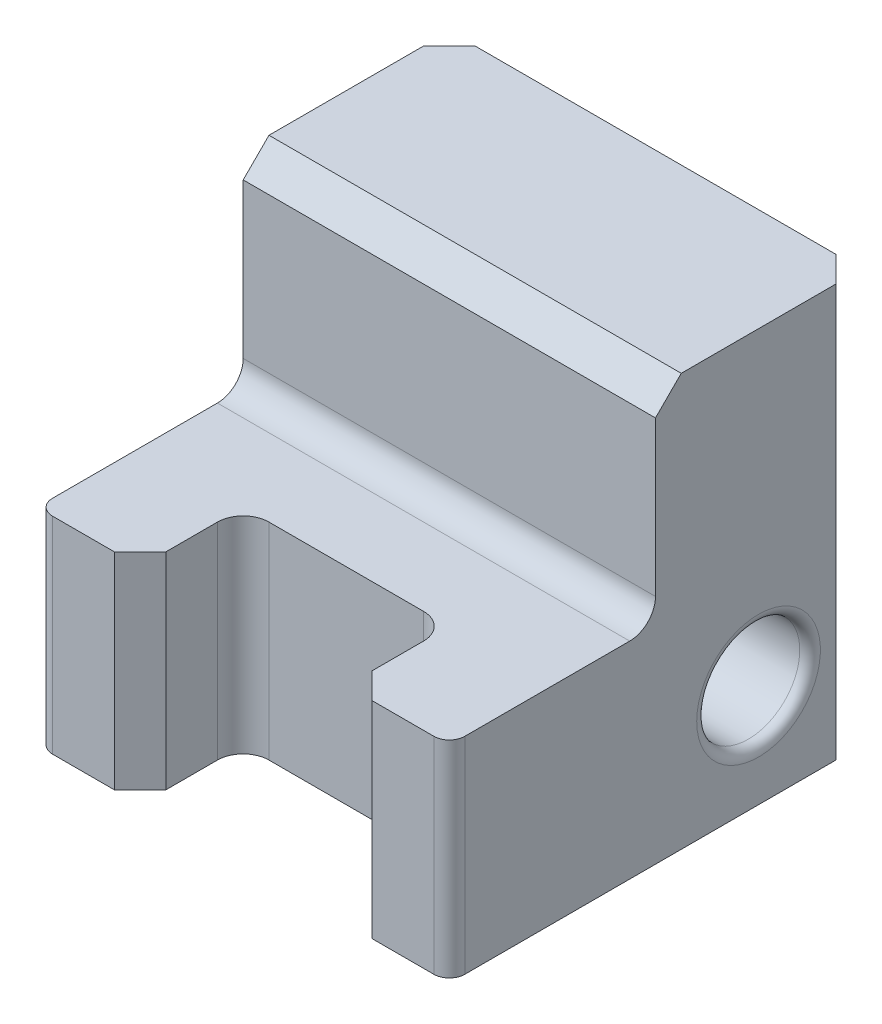
from build123d import *

# Parameters (mm, degrees)
SKETCH4_R           = 10
BOSS_EXTRUDE1_DEPTH = 80
SKETCH5_W           = 40
SKETCH5_H           = 20
CUT_EXTRUDE1_DEPTH  = 139.564064606
FILLET1_R           = 3
CHAMFER1_SIZE       = 5
FILLET2_R           = 5
FILLET4_R           = 5
CHAMFER3_SIZE       = 5
FILLET5_R           = 2
FILLET6_R           = 2
CHAMFER4_SIZE       = 5
CHAMFER5_SIZE       = 5


with BuildPart() as part:
    # Sketch4 → Boss-Extrude1 (new body)
    with BuildSketch(Plane(origin=(0, 0, 0), x_dir=(0, 0, -1), z_dir=(1, 0, 0))):
        Polygon((0, 0), (-80, 0), (-80, 40), (-40, 40), (-40, 80), (0, 80), align=None)
        with Locations((-20, 20)):
            Circle(SKETCH4_R, mode=Mode.SUBTRACT)
    extrude(amount=BOSS_EXTRUDE1_DEPTH)

    # Sketch5 → Cut-Extrude1 (cut, through all)
    with BuildSketch(Plane.XZ):
        with Locations((40, 70)):
            Rectangle(SKETCH5_W, SKETCH5_H)
    extrude(amount=-CUT_EXTRUDE1_DEPTH, mode=Mode.SUBTRACT)

    # Fillet1
    fillet1_edges = [part.edges().sort_by_distance(p)[0] for p in [
        (80, 20, 80),
        (0, 20, 80),
    ]]
    fillet(fillet1_edges, radius=FILLET1_R)

    # Chamfer1
    chamfer1_edges = [part.edges().sort_by_distance(p)[0] for p in [
        (60, 20, 80),
        (20, 20, 80),
    ]]
    chamfer(chamfer1_edges, length=CHAMFER1_SIZE)

    # Fillet2
    fillet2_edges = [part.edges().sort_by_distance(p)[0] for p in [
        (20, 20, 60),
        (60, 20, 60),
    ]]
    fillet(fillet2_edges, radius=FILLET2_R)

    # Fillet4
    fillet4_edges = [part.edges().sort_by_distance(p)[0] for p in [
        (40, 40, 40),
    ]]
    fillet(fillet4_edges, radius=FILLET4_R)

    # Chamfer3
    chamfer3_edges = [part.edges().sort_by_distance(p)[0] for p in [
        (40, 80, 40),
    ]]
    chamfer(chamfer3_edges, length=CHAMFER3_SIZE)

    # Fillet5
    fillet5_edges = [part.edges().sort_by_distance(p)[0] for p in [
        (0, 20, 30),
    ]]
    fillet(fillet5_edges, radius=FILLET5_R)

    # Fillet6
    fillet6_edges = [part.edges().sort_by_distance(p)[0] for p in [
        (80, 20, 30),
    ]]
    fillet(fillet6_edges, radius=FILLET6_R)

    # Chamfer4
    chamfer4_edges = [part.edges().sort_by_distance(p)[0] for p in [
        (80, 40, 0),
    ]]
    chamfer(chamfer4_edges, length=CHAMFER4_SIZE)

    # Chamfer5
    chamfer5_edges = [part.edges().sort_by_distance(p)[0] for p in [
        (0, 40, 0),
    ]]
    chamfer(chamfer5_edges, length=CHAMFER5_SIZE)


solid = part.part
